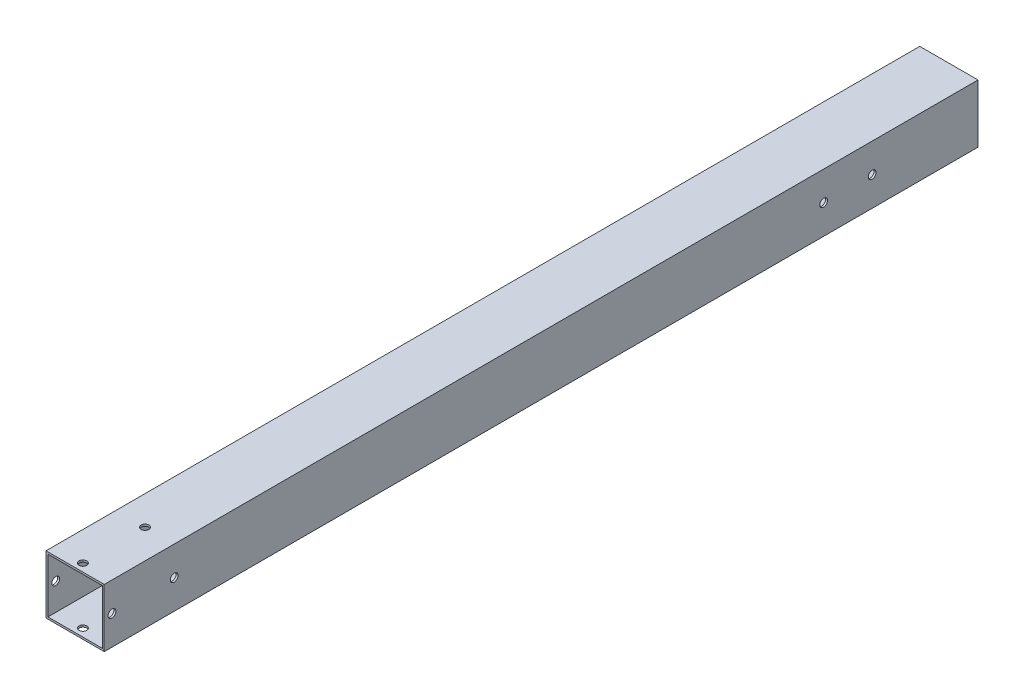
from build123d import *

# Parameters (mm, degrees)
SKETCH_1_W          = 30
SKETCH_1_H          = 30
SKETCH_1_W_2        = 28
SKETCH_1_H_2        = 28
EXTRUDE_1_DEPTH     = 225
SKETCH_2_R          = 2
CUT_EXTRUDE_1_DEPTH = 65
SKETCH_4_R          = 2
CUT_EXTRUDE_2_DEPTH = 45
SKETCH_5_R          = 2
CUT_EXTRUDE_3_DEPTH = 45


with BuildPart() as part:
    # 草图1 → 凸台-拉伸1 (new, symmetric)
    with BuildSketch(Plane.XY):
        Rectangle(SKETCH_1_W, SKETCH_1_H)
        Rectangle(SKETCH_1_W_2, SKETCH_1_H_2, mode=Mode.SUBTRACT)
    extrude(amount=EXTRUDE_1_DEPTH, both=True)

    # 草图2 → 切除-拉伸1 (cut, symmetric)
    with BuildSketch(Plane(origin=(15, 0, 0), x_dir=(0, 0, -1), z_dir=(1, 0, 0))):
        with Locations((145.5, 0)):
            Circle(SKETCH_2_R)
        with Locations((170.5, 0)):
            Circle(SKETCH_2_R)
    extrude(amount=CUT_EXTRUDE_1_DEPTH, both=True, mode=Mode.SUBTRACT)

    # 草图4 → 切除-拉伸2 (cut, symmetric)
    with BuildSketch(Plane.XZ.offset(15)):
        with Locations(Location((0, 221, 0), (0, 0, 270))):
            Circle(SKETCH_4_R)
        with Locations(Location((0, 189, 0), (0, 0, 270))):
            Circle(SKETCH_4_R)
    extrude(amount=CUT_EXTRUDE_2_DEPTH, both=True, mode=Mode.SUBTRACT)

    # 草图5 → 切除-拉伸3 (cut, symmetric)
    with BuildSketch(Plane(origin=(15, 0, 0), x_dir=(0, 0, -1), z_dir=(1, 0, 0))):
        with Locations((-221, 0)):
            Circle(SKETCH_5_R)
        with Locations((-189, 0)):
            Circle(SKETCH_5_R)
    extrude(amount=CUT_EXTRUDE_3_DEPTH, both=True, mode=Mode.SUBTRACT)


solid = part.part
